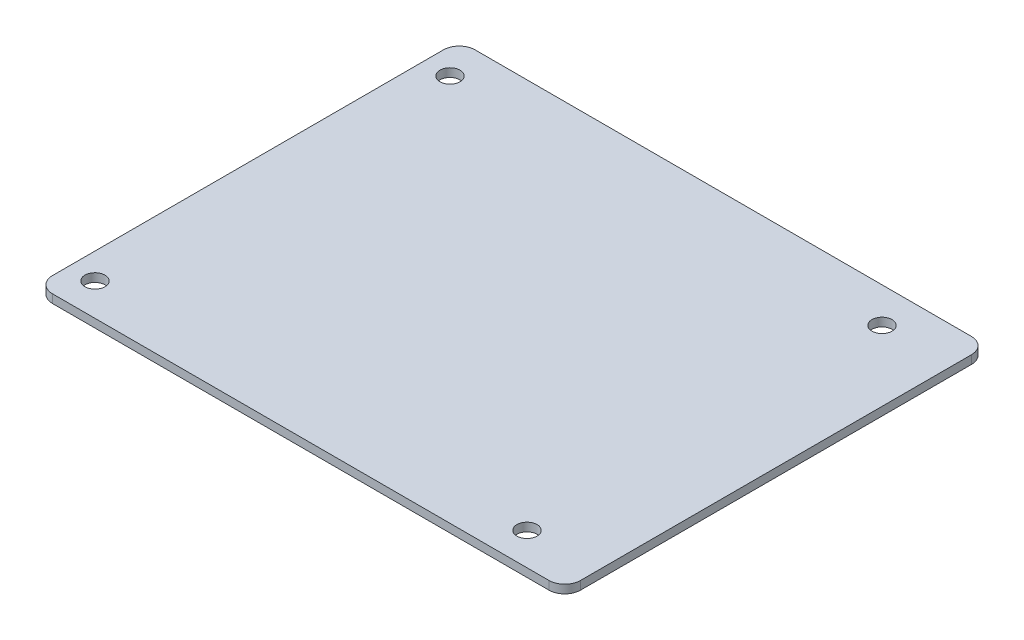
from build123d import *

# Parameters (mm, degrees)
SKETCH1_W           = 100.12
SKETCH1_H           = 80.12
BOSS_EXTRUDE1_DEPTH = 0.8
FILLET1_R           = 3
CUT_EXTRUDE1_REACH  = 66.136
SKETCH2_R           = 1.905


with BuildPart() as part:
    # Sketch1 → Boss-Extrude1 (new, symmetric)
    with BuildSketch(Plane(origin=(0, 0, 0), x_dir=(1, 0, 0), z_dir=(0, 1, 0))):
        Rectangle(SKETCH1_W, SKETCH1_H)
    extrude(amount=BOSS_EXTRUDE1_DEPTH, both=True)

    # Fillet1
    fillet1_edges = [part.edges().sort_by_distance(p)[0] for p in [
        (-50.06, 0, -40.06),
        (50.06, 0, -40.06),
        (50.06, 0, 40.06),
        (-50.06, 0, 40.06),
    ]]
    fillet(fillet1_edges, radius=FILLET1_R)

    # Sketch2 → Cut-Extrude1 (cut, up to next)
    with BuildSketch(Plane(origin=(0, 0.8, 0), x_dir=(1, 0, 0), z_dir=(0, 1, 0)), mode=Mode.PRIVATE) as cut_extrude1_sk1:
        with Locations(Location((-45.155, 33.3925, 0), (0, 0, 270))):
            Circle(SKETCH2_R)
    cut_extrude1_tool1 = extrude(cut_extrude1_sk1.sketch, amount=-CUT_EXTRUDE1_REACH, mode=Mode.PRIVATE) & part.part
    # Sketch2 → Cut-Extrude1 (cut, up to next)
    with BuildSketch(Plane(origin=(0, 0.8, 0), x_dir=(1, 0, 0), z_dir=(0, 1, 0)), mode=Mode.PRIVATE) as cut_extrude1_sk2:
        with Locations(Location((-45.155, -33.9175, 0), (0, 0, 270))):
            Circle(SKETCH2_R)
    cut_extrude1_tool2 = extrude(cut_extrude1_sk2.sketch, amount=-CUT_EXTRUDE1_REACH, mode=Mode.PRIVATE) & part.part
    # Sketch2 → Cut-Extrude1 (cut, up to next)
    with BuildSketch(Plane(origin=(0, 0.8, 0), x_dir=(1, 0, 0), z_dir=(0, 1, 0)), mode=Mode.PRIVATE) as cut_extrude1_sk3:
        with Locations(Location((36.76, -33.9175, 0), (0, 0, 270))):
            Circle(SKETCH2_R)
    cut_extrude1_tool3 = extrude(cut_extrude1_sk3.sketch, amount=-CUT_EXTRUDE1_REACH, mode=Mode.PRIVATE) & part.part
    # Sketch2 → Cut-Extrude1 (cut, up to next)
    with BuildSketch(Plane(origin=(0, 0.8, 0), x_dir=(1, 0, 0), z_dir=(0, 1, 0)), mode=Mode.PRIVATE) as cut_extrude1_sk4:
        with Locations(Location((36.76, 33.3925, 0), (0, 0, 270))):
            Circle(SKETCH2_R)
    cut_extrude1_tool4 = extrude(cut_extrude1_sk4.sketch, amount=-CUT_EXTRUDE1_REACH, mode=Mode.PRIVATE) & part.part
    add(cut_extrude1_tool1.solids().sort_by_distance((-45.155, 0.8, -33.3925))[0], mode=Mode.SUBTRACT)
    add(cut_extrude1_tool2.solids().sort_by_distance((-45.155, 0.8, 33.9175))[0], mode=Mode.SUBTRACT)
    add(cut_extrude1_tool3.solids().sort_by_distance((36.76, 0.8, 33.9175))[0], mode=Mode.SUBTRACT)
    add(cut_extrude1_tool4.solids().sort_by_distance((36.76, 0.8, -33.3925))[0], mode=Mode.SUBTRACT)


solid = part.part
